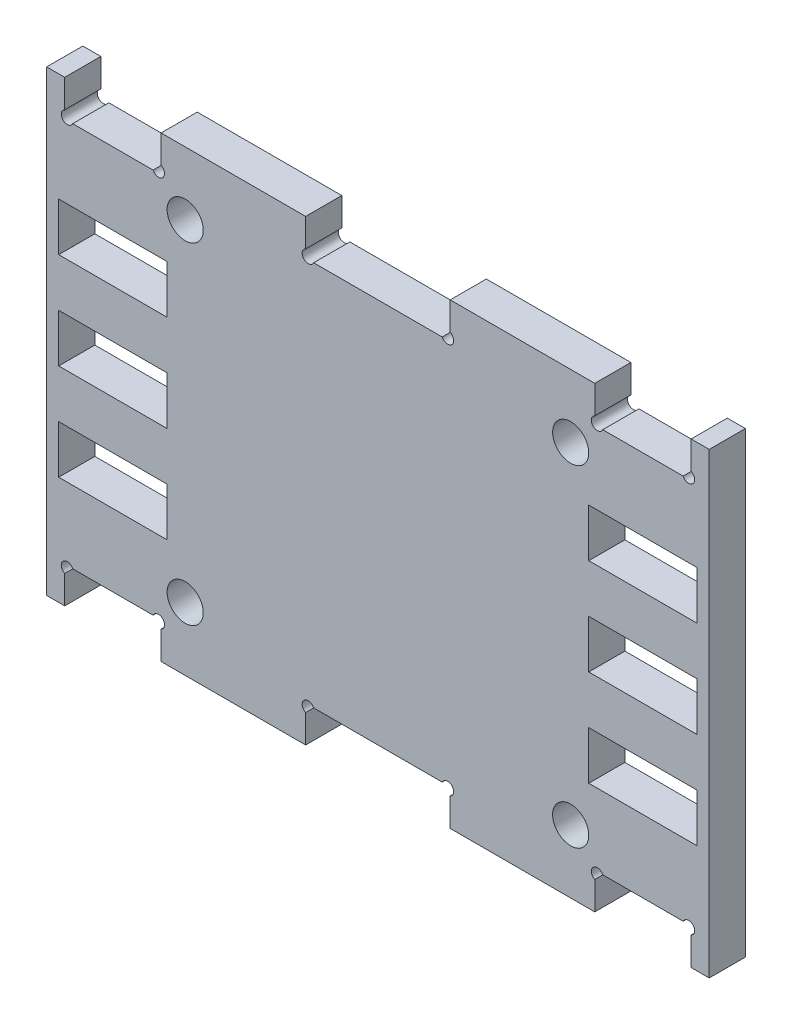
from build123d import *

# Parameters (mm, degrees)
SKETCH_1_W          = 55
SKETCH_1_H          = 38
EXTRUDE_1_DEPTH     = 3
SKETCH_2_R          = 1.5
CUT_EXTRUDE_1_DEPTH = 30
SKETCH_3_W          = 8
SKETCH_3_H          = 3
CUT_EXTRUDE_2_DEPTH = 30
SKETCH_5_W          = 12
SKETCH_5_H          = 3
CUT_EXTRUDE_4_DEPTH = 10
SKETCH_6_W          = 9
SKETCH_6_H          = 4
CUT_EXTRUDE_5_DEPTH = 10
SKETCH_7_R          = 0.5
CUT_EXTRUDE_6_DEPTH = 10


with BuildPart() as part:
    # 草图1 → 凸台-拉伸1 (new body)
    with BuildSketch(Plane.XY):
        Rectangle(SKETCH_1_W, SKETCH_1_H)
    extrude(amount=EXTRUDE_1_DEPTH)

    # 草图2 → 切除-拉伸1 (cut)
    with BuildSketch(Plane.XY.offset(3)):
        with Locations((16, 13.75)):
            Circle(SKETCH_2_R)
        with Locations((16, -13.75)):
            Circle(SKETCH_2_R)
        with Locations((-16, 13.75)):
            Circle(SKETCH_2_R)
        with Locations((-16, -13.75)):
            Circle(SKETCH_2_R)
    extrude(amount=-CUT_EXTRUDE_1_DEPTH, mode=Mode.SUBTRACT)

    # 草图3 → 切除-拉伸2 (cut)
    with BuildSketch(Plane.XY.offset(3)):
        with Locations((22, 17.5)):
            Rectangle(SKETCH_3_W, SKETCH_3_H)
        with Locations((22, -17.5)):
            Rectangle(SKETCH_3_W, SKETCH_3_H)
        with Locations((-22, 17.5)):
            Rectangle(SKETCH_3_W, SKETCH_3_H)
        with Locations((-22, -17.5)):
            Rectangle(SKETCH_3_W, SKETCH_3_H)
    extrude(amount=-CUT_EXTRUDE_2_DEPTH, mode=Mode.SUBTRACT)

    # 草图5 → 切除-拉伸4 (cut)
    with BuildSketch(Plane.XY.offset(3)):
        with Locations((0, -17.5)):
            Rectangle(SKETCH_5_W, SKETCH_5_H)
        with Locations((0, 17.5)):
            Rectangle(SKETCH_5_W, SKETCH_5_H)
    extrude(amount=-CUT_EXTRUDE_4_DEPTH, mode=Mode.SUBTRACT)

    # 草图6 → 切除-拉伸5 (cut)
    with BuildSketch(Plane(origin=(0, 0, 0), x_dir=(-1, 0, 0), z_dir=(0, 0, -1))):
        with Locations((-22, -8)):
            Rectangle(SKETCH_6_W, SKETCH_6_H)
        with Locations((-22, 0)):
            Rectangle(SKETCH_6_W, SKETCH_6_H)
        with Locations((-22, 8)):
            Rectangle(SKETCH_6_W, SKETCH_6_H)
        with Locations((22, -8)):
            Rectangle(SKETCH_6_W, SKETCH_6_H)
        with Locations((22, 0)):
            Rectangle(SKETCH_6_W, SKETCH_6_H)
        with Locations((22, 8)):
            Rectangle(SKETCH_6_W, SKETCH_6_H)
    extrude(amount=-CUT_EXTRUDE_5_DEPTH, mode=Mode.SUBTRACT)

    # 草图7 → 切除-拉伸6 (cut)
    with BuildSketch(Plane(origin=(0, 0, 0), x_dir=(-1, 0, 0), z_dir=(0, 0, -1))):
        with Locations((-18.212132034, -16.212132034)):
            Circle(SKETCH_7_R)
        with Locations((-25.787867966, -16.212132034)):
            Circle(SKETCH_7_R)
        with Locations((-25.787867966, 16.212132034)):
            Circle(SKETCH_7_R)
        with Locations((-18.212132034, 16.212132034)):
            Circle(SKETCH_7_R)
        with Locations((-5.787867966, -16.212132034)):
            Circle(SKETCH_7_R)
        with Locations((25.787867966, -16.212132034)):
            Circle(SKETCH_7_R)
        with Locations((18.212132034, -16.212132034)):
            Circle(SKETCH_7_R)
        with Locations((18.212132034, 16.212132034)):
            Circle(SKETCH_7_R)
        with Locations((25.787867966, 16.212132034)):
            Circle(SKETCH_7_R)
        with Locations((-5.787867966, 16.212132034)):
            Circle(SKETCH_7_R)
        with Locations((5.787867966, 16.212132034)):
            Circle(SKETCH_7_R)
        with Locations((5.787867966, -16.212132034)):
            Circle(SKETCH_7_R)
    extrude(amount=-CUT_EXTRUDE_6_DEPTH, mode=Mode.SUBTRACT)


solid = part.part
